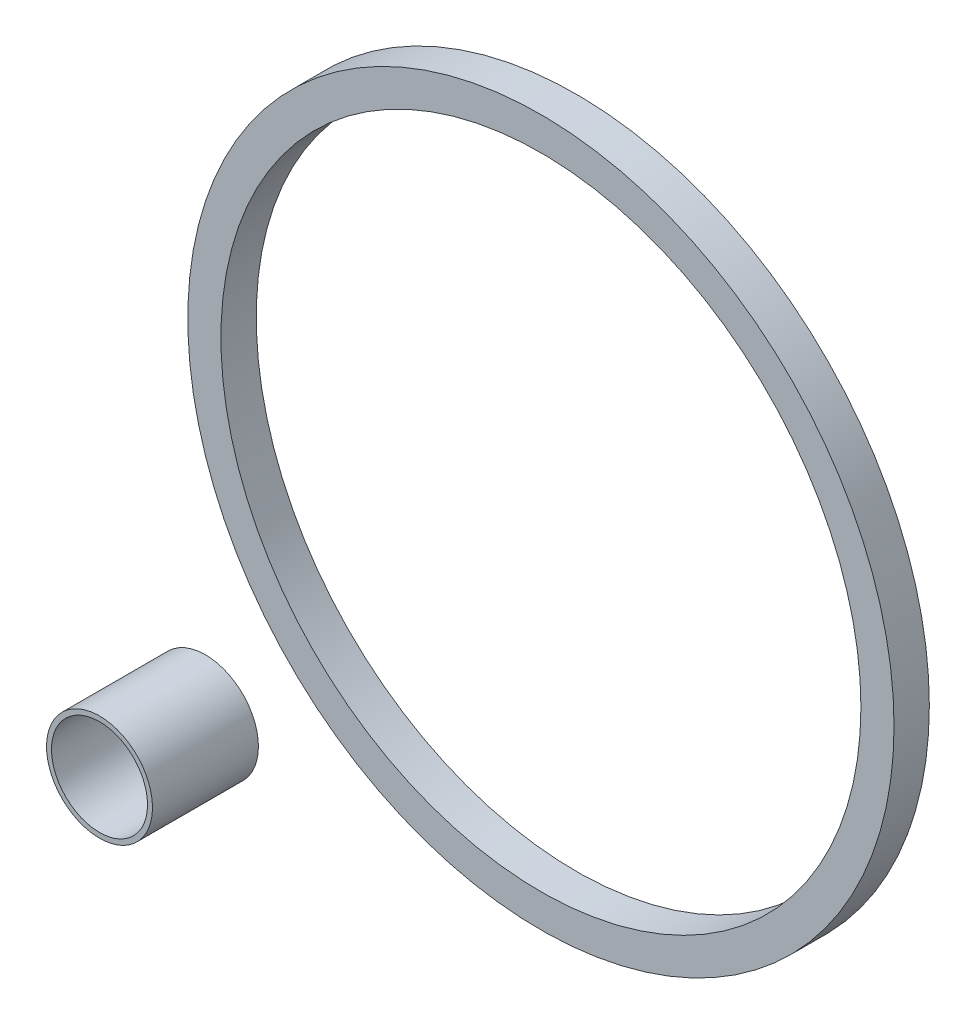
from build123d import *

# Parameters (mm, degrees)
SKETCH3_R           = 1000
BOSS_EXTRUDE2_DEPTH = 2000
SKETCH8_R           = 1000
BOSS_EXTRUDE7_DEPTH = 100
SKETCH9_R           = 906.211014964
CUT_EXTRUDE3_DEPTH  = 6000
SCALE5_SCALE        = 0.15


with BuildPart() as part:
    # Sketch3 → Boss-Extrude2 (new body)
    with BuildSketch(Plane.XY.offset(200)):
        Circle(SKETCH3_R)
    extrude(amount=BOSS_EXTRUDE2_DEPTH)


with BuildPart() as body_2:
    # Sketch8 → Boss-Extrude7 (new body)
    with BuildSketch(Plane.XY):
        Circle(SKETCH8_R)
    extrude(amount=BOSS_EXTRUDE7_DEPTH)


with BuildPart() as cut_extrude3_tool:
    # Sketch9 → Cut-Extrude3 (new body)
    with BuildSketch(Plane.XY):
        Circle(SKETCH9_R)
    extrude(amount=CUT_EXTRUDE3_DEPTH)


with BuildPart() as part_1:
    add(part.part)

    # Cut-Extrude3: cut by cut_extrude3_tool
    add(cut_extrude3_tool.part, mode=Mode.SUBTRACT)


with BuildPart() as body_2_1:
    add(body_2.part)

    # Cut-Extrude3: cut by cut_extrude3_tool
    add(cut_extrude3_tool.part, mode=Mode.SUBTRACT)


with BuildPart() as part_2:
    # Scale5: scaled about (0, 0, 1200)
    add(part_1.part.scale(SCALE5_SCALE).moved(Location((0, 0, 1020))))


solid = Compound([body_2_1.part, part_2.part])
